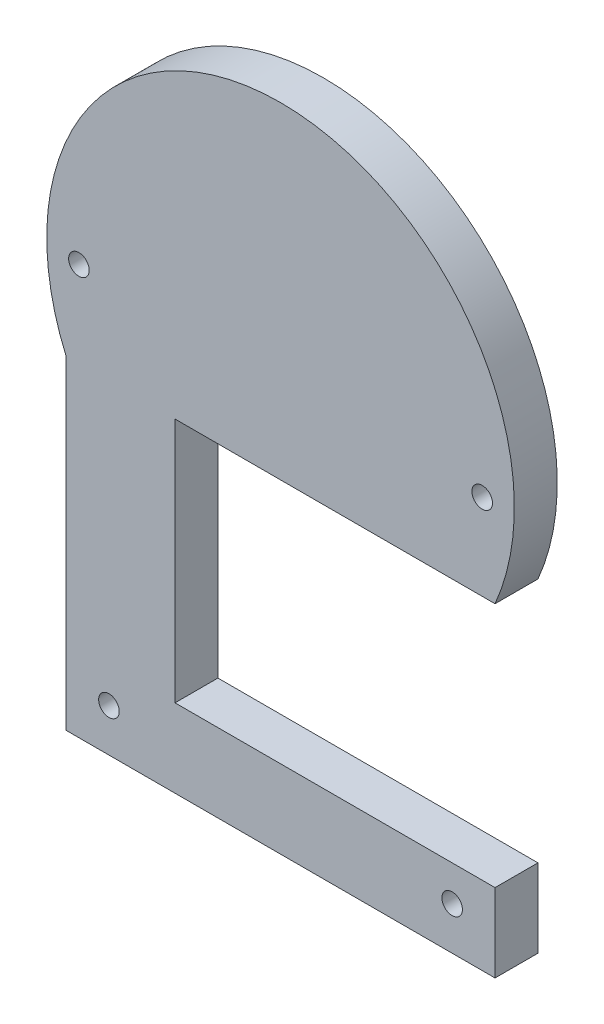
from build123d import *

# Parameters (mm, degrees)
BOSS_EXTRUDE1_DEPTH                             = 10
CSK_FOR_M4_FLAT_HEAD_MACHINE_SCREW1_D           = 4.8
CSK_FOR_M4_FLAT_HEAD_MACHINE_SCREW1_CSINK_D     = 9.4
CSK_FOR_M4_FLAT_HEAD_MACHINE_SCREW1_CSINK_ANGLE = 90
SKETCH6_W                                       = 74.6
SKETCH6_H                                       = 57.3
CUT_EXTRUDE1_DEPTH                              = 15


with BuildPart() as part:
    # Sketch1 → Boss-Extrude1 (new body)
    with BuildSketch(Plane(origin=(0, 0, 0), x_dir=(-1, 0, 0), z_dir=(0, 0, 1))):
        with BuildLine():
            Line((-50, 21.685248442), (-50, 97.235188276))
            Line((-50, 97.235188276), (50, 97.235188276))
            Line((50, 97.235188276), (50, 21.685248442))
            ThreePointArc((50, 21.685248442), (0, -54.5), (-50, 21.685248442))
        make_face()
    extrude(amount=BOSS_EXTRUDE1_DEPTH)

    # CSK for M4 Flat Head Machine Screw1 (through all)
    with Locations(Plane(origin=(47, -1.685248442, 0), x_dir=(-1, 0, 0), z_dir=(0, 0, -1))):
        with Locations((0, 0), (94, 0), (87, -85.549939834), (7, -85.549939834)):
            CounterSinkHole(CSK_FOR_M4_FLAT_HEAD_MACHINE_SCREW1_D / 2, CSK_FOR_M4_FLAT_HEAD_MACHINE_SCREW1_CSINK_D / 2, counter_sink_angle=CSK_FOR_M4_FLAT_HEAD_MACHINE_SCREW1_CSINK_ANGLE)

    # Sketch6 → Cut-Extrude1 (cut)
    with BuildSketch(Plane.XY.offset(10)):
        with Locations((12.7, -50.335248442)):
            Rectangle(SKETCH6_W, SKETCH6_H)
    extrude(amount=-CUT_EXTRUDE1_DEPTH, mode=Mode.SUBTRACT)


solid = part.part
